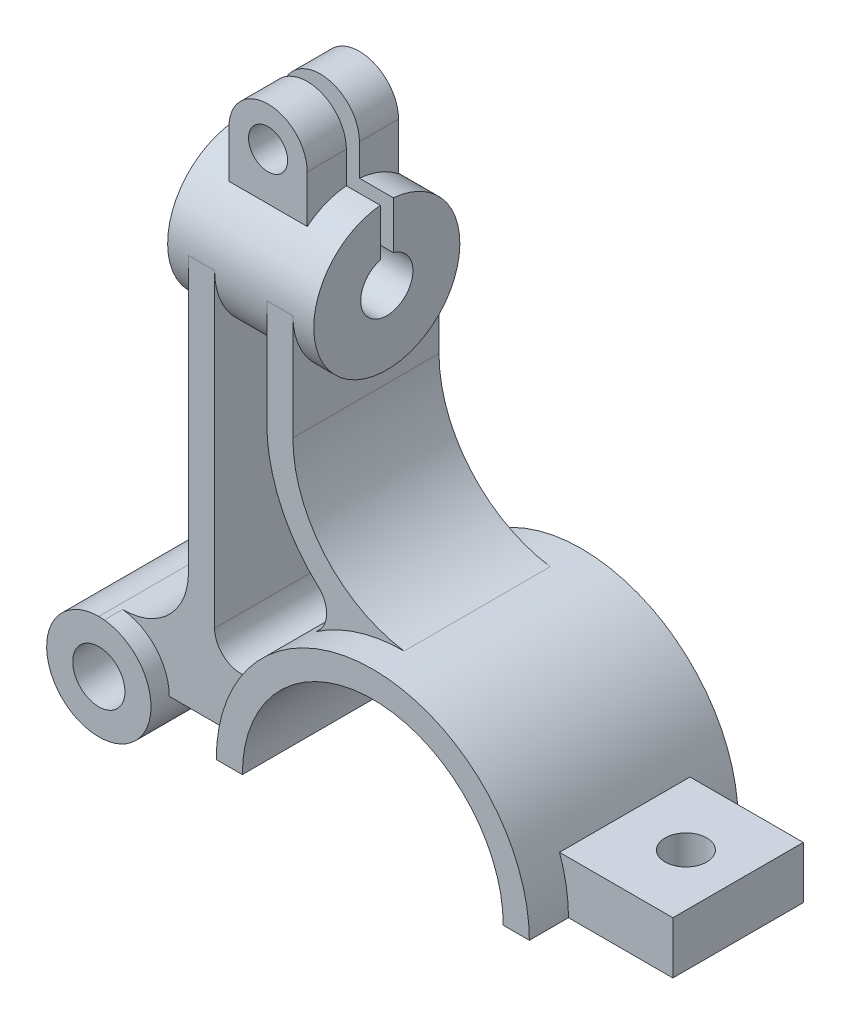
from build123d import *

# Parameters (mm, degrees)
BOSS_EXTRUDE1_DEPTH = 40
SKETCH1_3_R         = 9.999999999999993
BOSS_EXTRUDE2_DEPTH = 35
BOSS_EXTRUDE3_DEPTH = 28
BOSS_EXTRUDE4_DEPTH = 25
SKETCH3_R           = 8.000000000000012
CUT_EXTRUDE1_DEPTH  = 67
SKETCH8_R           = 27.999999999999996
BOSS_EXTRUDE5_DEPTH = 28
SKETCH9_R           = 7.500000000000014
BOSS_EXTRUDE6_DEPTH = 17.5
SKETCH10_R          = 10.000000000000004
CUT_EXTRUDE3_DEPTH  = 60
SKETCH10_4_R        = 10.000000000000004
CUT_EXTRUDE4_DEPTH  = 60


with BuildPart() as part:
    # Sketch1 → Boss-Extrude1 (new, symmetric)
    with BuildSketch(Plane.XY):
        with BuildLine():
            ThreePointArc((50, 0), (3.06e-15, 50), (-50, 0))
            Line((-50, 0), (-60, 0))
            ThreePointArc((-60, 0), (3.67e-15, 60), (60, 0))
            Line((60, 0), (50, 0))
        make_face()
    extrude(amount=BOSS_EXTRUDE1_DEPTH, both=True)



with BuildPart() as body_2:
    # Sketch1<3> → Boss-Extrude2 (new, symmetric)
    with BuildSketch(Plane.XY):
        with BuildLine():
            ThreePointArc((-110, 19.999999999999986), (-124.14213562373095, -14.142135623730939), (-90.00000000000001, -4.9e-15))
            ThreePointArc((-90.00000000000001, 0), (-95.13196534092553, 13.376903430037897), (-107.894154537656, 19.88882638288958))
            ThreePointArc((-107.894154537656, 19.888826382889572), (-108.94824999295787, 19.92219950575522), (-110, 20))
        make_face()
        with Locations((-110, 0)):
            Circle(SKETCH1_3_R, mode=Mode.SUBTRACT)
    extrude(amount=BOSS_EXTRUDE2_DEPTH, both=True)


with BuildPart() as part_1:
    add(part.part)

    add(body_2.part)  # Boss-Extrude3 merges body 2
    # Sketch1<6> → Boss-Extrude3 (add, symmetric)
    with BuildSketch(Plane.XY):
        with BuildLine():
            ThreePointArc((-32.98168393227754, 65.04935068656462), (-29.729511757993123, 56.976796834196755), (-34.03450339822838, 49.413081045771484))
            ThreePointArc((-34.034503398228374, 49.413081045771484), (-17.821547874044366, 57.29216727767544), (-1.66e-15, 59.99999999999999))
            ThreePointArc((-1.78e-15, 59.99999999999999), (-30.50166992482464, 76.80795981518852), (-42.63026373834409, 109.45388748555197))
            Line((-42.630263738344084, 109.45388748555196), (-42.63026373834409, 150))
            Line((-42.63026373834409, 150), (-52.63026373834409, 150))
            Line((-52.63026373834409, 150), (-52.63026373834409, 139.99999999999997))
            Line((-52.63026373834409, 139.99999999999997), (-52.630263738344084, 109.45388748555197))
            ThreePointArc((-52.63026373834408, 109.45388748555197), (-47.498675468756, 85.17514381579021), (-32.981683932277534, 65.04935068656462))
        make_face()
        with BuildLine():
            Line((-90, -3.21e-15), (-60, 0))
            ThreePointArc((-60, -3.31e-15), (-58.39942205303789, 13.766172448111766), (-53.68308320429493, 26.797883828406057))
            ThreePointArc((-53.683083204294945, 26.79788382840606), (-64.92462581302938, 21.530960790967427), (-72.63026373834407, 31.26419779980706))
            Line((-72.63026373834407, 31.264197799807064), (-72.6302637383441, 139.99999999999997))
            Line((-72.6302637383441, 139.99999999999997), (-72.6302637383441, 150))
            Line((-72.6302637383441, 150), (-82.63026373834408, 150))
            Line((-82.63026373834408, 150), (-82.63026373834408, 44.88743357701219))
            ThreePointArc((-82.63026373834407, 44.88743357701218), (-90.04614121236624, 27.116709478332382), (-107.894154537656, 19.888826382889572))
            ThreePointArc((-107.894154537656, 19.88882638288958), (-95.13196534092553, 13.376903430037897), (-90.00000000000001, 0))
        make_face()
    extrude(amount=BOSS_EXTRUDE3_DEPTH, both=True)

    # Sketch1<7> → Boss-Extrude4 (add, symmetric)
    with BuildSketch(Plane.XY):
        with BuildLine():
            ThreePointArc((56.568542494923804, 19.999999999999993), (59.13591357920932, 10.146118723545761), (60, 0))
            Line((60, 0), (100, 0))
            Line((100, 0), (100, 20))
            Line((100, 20), (56.568542494923804, 19.999999999999993))
        make_face()
    extrude(amount=BOSS_EXTRUDE4_DEPTH, both=True)

    # Sketch3 → Cut-Extrude1 (cut)
    with BuildSketch(Plane(origin=(-3.2e-15, 19.999999999999982, 0), x_dir=(1, 1.6e-16, 0), z_dir=(-1.6e-16, 1, 0))):
        with Locations(Location((80, 0, 0), (0, 0, 180))):
            Circle(SKETCH3_R)
    extrude(amount=-CUT_EXTRUDE1_DEPTH, mode=Mode.SUBTRACT)

    # Sketch8 → Boss-Extrude5 (add, symmetric)
    with BuildSketch(Plane(origin=(-62.630263738344055, -1.072e-14, 0), x_dir=(0, 0, -1), z_dir=(1, 1.7e-16, 0))):
        with Locations(Location((0, 150, 0), (0, 0, 90))):
            Circle(SKETCH8_R)
    extrude(amount=BOSS_EXTRUDE5_DEPTH, both=True)

    # Sketch9 → Boss-Extrude6 (add, symmetric)
    with BuildSketch(Plane.XY):
        with BuildLine():
            Line((-77.63026373834407, 190), (-77.63026373834407, 170))
            Line((-77.63026373834407, 170), (-47.63026373834407, 170))
            Line((-47.63026373834407, 170), (-47.63026373834407, 190))
            ThreePointArc((-47.63026373834407, 190), (-62.63026373834407, 205), (-77.63026373834407, 190))
        make_face()
        with Locations((-62.63026373834407, 190)):
            Circle(SKETCH9_R, mode=Mode.SUBTRACT)
    extrude(amount=BOSS_EXTRUDE6_DEPTH, both=True)

    # Sketch10 → Cut-Extrude3 (cut)
    with BuildSketch(Plane(origin=(-34.630263738344055, -5.93e-15, 0), x_dir=(0, 0, -1), z_dir=(1, 1.7e-16, 0))):
        with Locations(Location((0, 150, 0), (0, 0, 90))):
            Circle(SKETCH10_R)
    extrude(amount=-CUT_EXTRUDE3_DEPTH, mode=Mode.SUBTRACT)

    # Sketch10<4> → Cut-Extrude4 (cut)
    with BuildSketch(Plane(origin=(-34.630263738344055, -5.93e-15, 0), x_dir=(0, 0, -1), z_dir=(1, 1.7e-16, 0))):
        with Locations((0, 150)):
            Circle(SKETCH10_4_R)
        Polygon((-2.5, 150), (2.5, 150), (2.5000000000000004, 205.00000000000003), (-2.5, 205.00000000000003), align=None)
    extrude(amount=-CUT_EXTRUDE4_DEPTH, mode=Mode.SUBTRACT)


solid = part_1.part
